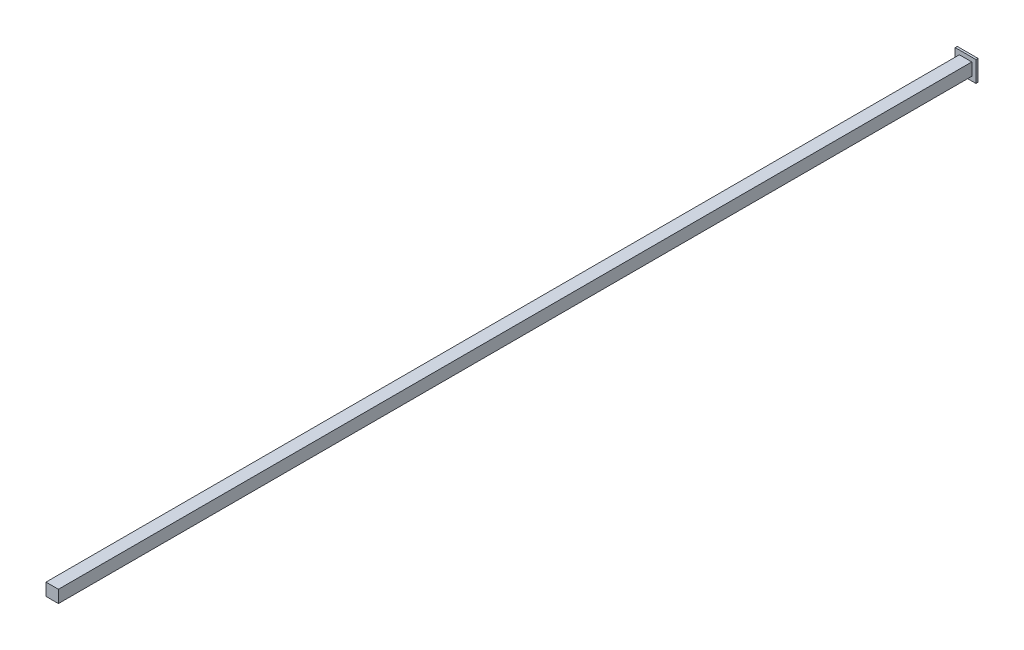
from build123d import *

# Parameters (mm, degrees)
SCHIZZO1_W                   = 50
SCHIZZO1_H                   = 50
ESTRUSIONE_ESTRUSIONE1_DEPTH = 5
SCHIZZO2_W                   = 30
SCHIZZO2_H                   = 30
SCHIZZO2_W_2                 = 24
SCHIZZO2_H_2                 = 24
ESTRUSIONE_ESTRUSIONE2_DEPTH = 2205
SCHIZZO3_W                   = 24
SCHIZZO3_H                   = 24
ESTRUSIONE_ESTRUSIONE3_DEPTH = 5


with BuildPart() as part:
    # Schizzo1 → Estrusione-Estrusione1 (new body)
    with BuildSketch(Plane.XY):
        Rectangle(SCHIZZO1_W, SCHIZZO1_H)
    extrude(amount=ESTRUSIONE_ESTRUSIONE1_DEPTH)

    # Schizzo2 → Estrusione-Estrusione2 (add)
    with BuildSketch(Plane.XY.offset(5)):
        Rectangle(SCHIZZO2_W, SCHIZZO2_H)
        Rectangle(SCHIZZO2_W_2, SCHIZZO2_H_2, mode=Mode.SUBTRACT)
    extrude(amount=ESTRUSIONE_ESTRUSIONE2_DEPTH)

    # Schizzo3 → Estrusione-Estrusione3 (add)
    with BuildSketch(Plane.XY.offset(2210)):
        Rectangle(SCHIZZO3_W, SCHIZZO3_H)
    extrude(amount=-ESTRUSIONE_ESTRUSIONE3_DEPTH)


solid = part.part
